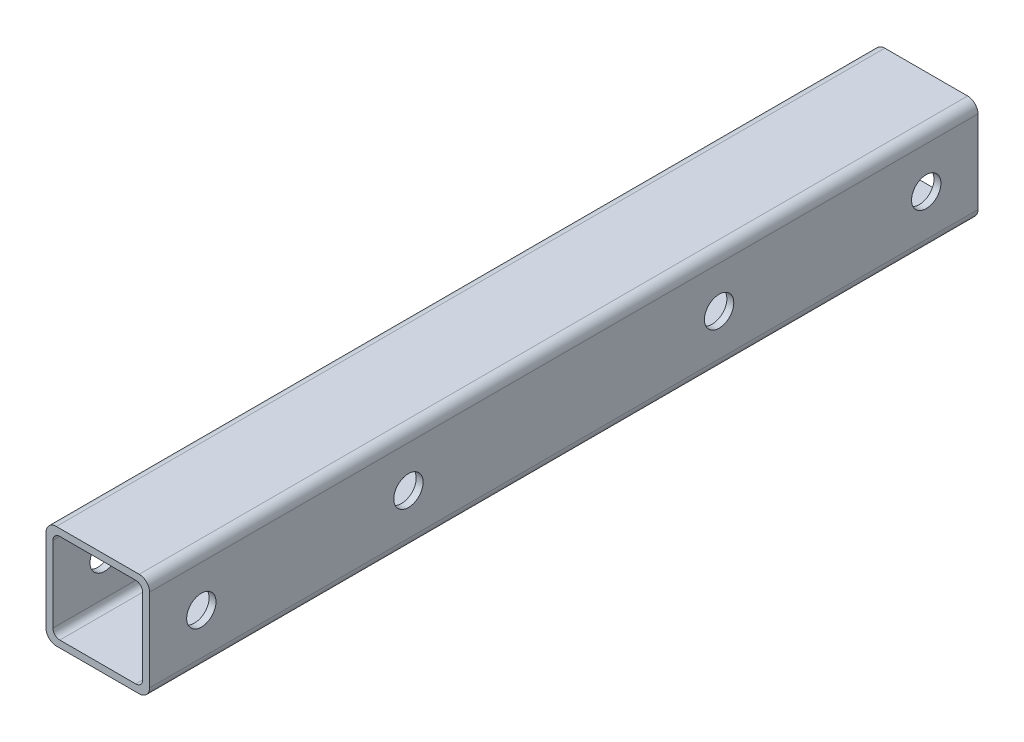
from build123d import *

# Parameters (mm, degrees)
EXTRUDE_1_DEPTH     = 240
SKETCH_2_R          = 4.25
CUT_EXTRUDE_1_DEPTH = 244.721152139


with BuildPart() as part:
    # Эскиз1 → Бобышка-Вытянуть1 (new body)
    with BuildSketch(Plane.XY):
        with BuildLine():
            Line((-12, 30), (12, 30))
            ThreePointArc((12, 30), (14.121320344, 29.121320344), (15, 27))
            Line((15, 27), (15, 3))
            ThreePointArc((15, 3), (14.121320344, 0.878679656), (12, 0))
            Line((12, 0), (-12, 0))
            ThreePointArc((-12, 0), (-14.121320344, 0.878679656), (-15, 3))
            Line((-15, 3), (-15, 27))
            ThreePointArc((-15, 27), (-14.121320344, 29.121320344), (-12, 30))
        make_face()
        with BuildLine():
            Line((-11, 28), (11, 28))
            ThreePointArc((11, 28), (12.414213562, 27.414213562), (13, 26))
            Line((13, 26), (13, 4))
            ThreePointArc((13, 4), (12.414213562, 2.585786438), (11, 2))
            Line((11, 2), (-11, 2))
            ThreePointArc((-11, 2), (-12.414213562, 2.585786438), (-13, 4))
            Line((-13, 4), (-13, 26))
            ThreePointArc((-13, 26), (-12.414213562, 27.414213562), (-11, 28))
        make_face(mode=Mode.SUBTRACT)
    extrude(amount=EXTRUDE_1_DEPTH)

    # Эскиз2 → Вырез-Вытянуть1 (cut, through all)
    with BuildSketch(Plane(origin=(15, 0, 0), x_dir=(0, 0, -1), z_dir=(1, 0, 0))):
        with Locations(Location((-225, 15, 0), (0, 0, 90))):
            Circle(SKETCH_2_R)
        with Locations(Location((-165, 15, 0), (0, 0, 90))):
            Circle(SKETCH_2_R)
        with Locations(Location((-75, 15, 0), (0, 0, 90))):
            Circle(SKETCH_2_R)
        with Locations(Location((-15, 15, 0), (0, 0, 90))):
            Circle(SKETCH_2_R)
    extrude(amount=-CUT_EXTRUDE_1_DEPTH, mode=Mode.SUBTRACT)


solid = part.part
